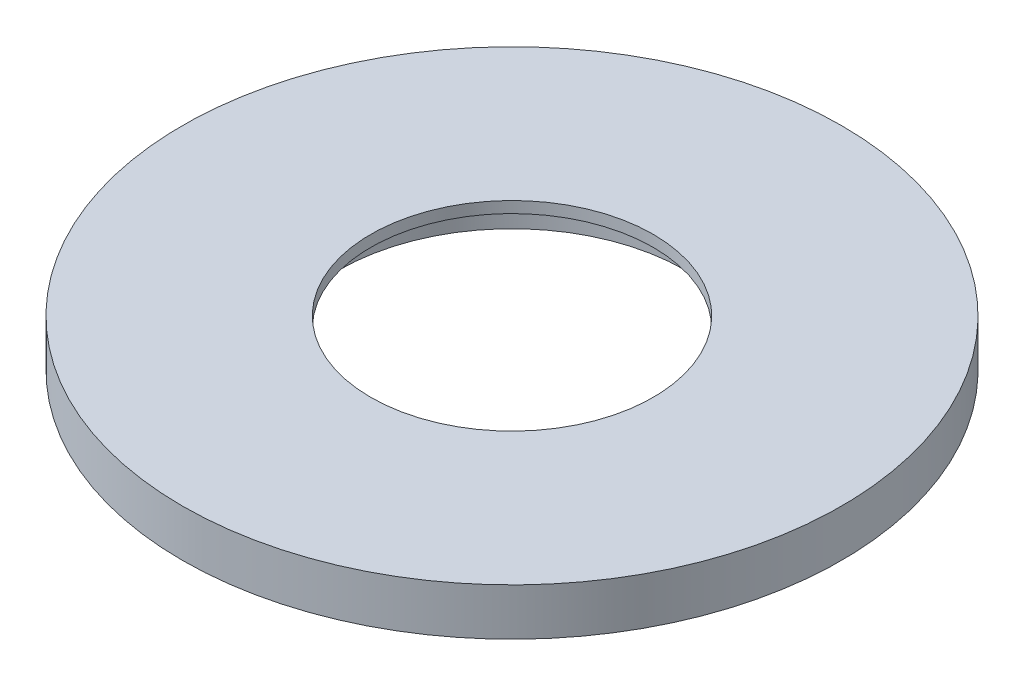
from build123d import *

# Parameters (mm, degrees)
SKETCH2_R           = 17.5
SKETCH2_R_2         = 9.2
BOSS_EXTRUDE1_DEPTH = 2.5
BOSS_EXTRUDE2_START = -0.6
SKETCH3_R           = 9.2
SKETCH3_R_2         = 7.5
BOSS_EXTRUDE2_DEPTH = 0.6
SKETCH4_R           = 1.67
CUT_EXTRUDE1_DEPTH  = 1.15
CIRPATTERN1_COUNT   = 4


with BuildPart() as part:
    # Sketch2 → Boss-Extrude1 (new body)
    with BuildSketch(Plane(origin=(0, 0, 0), x_dir=(1, 0, 0), z_dir=(0, 1, 0))):
        with Locations(Location((-21.383734207, -0.621346489, 0), (0, 0, 270))):
            Circle(SKETCH2_R)
        with Locations(Location((-21.383734207, -0.621346489, 0), (0, 0, 270))):
            Circle(SKETCH2_R_2, mode=Mode.SUBTRACT)
    extrude(amount=BOSS_EXTRUDE1_DEPTH)

    # Sketch3 → Boss-Extrude2 (add)
    with BuildSketch(Plane(origin=(0, 2.5, 0), x_dir=(1, 0, 0), z_dir=(0, 1, 0)).offset(BOSS_EXTRUDE2_START)):
        with Locations(Location((-21.383734207, -0.621346489, 0), (0, 0, 270))):
            Circle(SKETCH3_R)
        with Locations(Location((-21.383734207, -0.621346489, 0), (0, 0, 270))):
            Circle(SKETCH3_R_2, mode=Mode.SUBTRACT)
    extrude(amount=BOSS_EXTRUDE2_DEPTH)

    # Sketch4 → Cut-Extrude1 (cut)
    with BuildSketch(Plane.XZ):
        with Locations(Location((-21.569675845, 15.589648339, 0), (0, 0, 270))):
            Circle(SKETCH4_R)
    cut_extrude1 = extrude(amount=-CUT_EXTRUDE1_DEPTH, mode=Mode.SUBTRACT)

    # CirPattern1: Cut-Extrude1 ×4 about axis
    cirpattern1_axis = Axis((-21.383734207, 0, 0.621346489), (0, 1, 0))
    for i in range(1, CIRPATTERN1_COUNT):
        add(cut_extrude1.rotate(cirpattern1_axis, i * 360 / CIRPATTERN1_COUNT), mode=Mode.SUBTRACT)


solid = part.part
